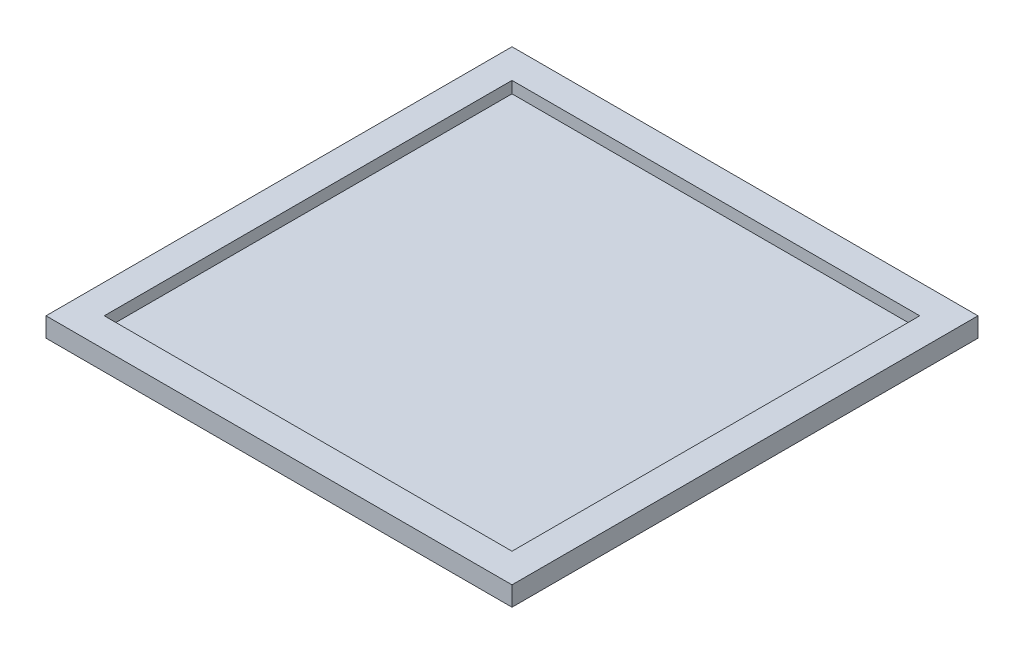
from build123d import *

# Parameters (mm, degrees)
SKETCH_1_W          = 120
SKETCH_1_H          = 120
EXTRUDE_1_DEPTH     = 5
SKETCH_2_W          = 105
SKETCH_2_H          = 105
CUT_EXTRUDE_1_DEPTH = 3


with BuildPart() as part:
    # Эскиз1 → Бобышка-Вытянуть1 (new body)
    with BuildSketch(Plane(origin=(0, 0, 0), x_dir=(1, 0, 0), z_dir=(0, 1, 0))):
        Rectangle(SKETCH_1_W, SKETCH_1_H)
    extrude(amount=EXTRUDE_1_DEPTH)

    # Эскиз2 → Вырез-Вытянуть1 (cut)
    with BuildSketch(Plane(origin=(0, 5, 0), x_dir=(1, 0, 0), z_dir=(0, 1, 0))):
        Rectangle(SKETCH_2_W, SKETCH_2_H)
    extrude(amount=-CUT_EXTRUDE_1_DEPTH, mode=Mode.SUBTRACT)


solid = part.part
